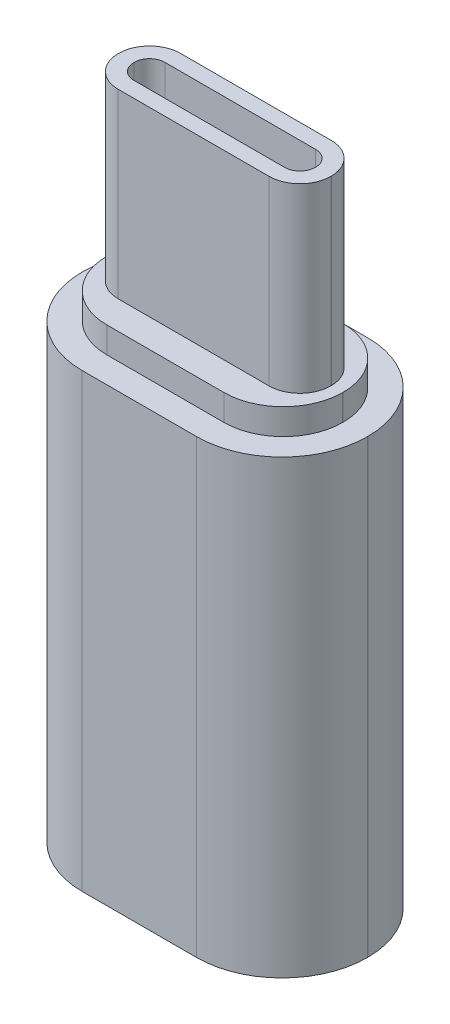
from build123d import *

# Parameters (mm, degrees)
BOSS_EXTRUDE1_DEPTH = 17.4
BOSS_EXTRUDE2_DEPTH = 1
BOSS_EXTRUDE3_DEPTH = 7
CUT_EXTRUDE1_DEPTH  = 4
CUT_EXTRUDE2_DEPTH  = 6.5
BOSS_EXTRUDE4_DEPTH = 2.1


with BuildPart() as part:
    # Sketch1 → Boss-Extrude1 (new body)
    with BuildSketch(Plane(origin=(0, 0, 0), x_dir=(1, 0, 0), z_dir=(0, 1, 0))):
        with BuildLine():
            Line((3.29, 0), (7.71, 0))
            ThreePointArc((7.71, 0), (10.03638131, 0.96361869), (11, 3.29))
            Line((11, 3.29), (11, 3.31))
            ThreePointArc((11, 3.31), (10.03638131, 5.63638131), (7.71, 6.6))
            Line((7.71, 6.6), (3.29, 6.6))
            ThreePointArc((3.29, 6.6), (0.96361869, 5.63638131), (0, 3.31))
            Line((0, 3.31), (0, 3.29))
            ThreePointArc((0, 3.29), (0.96361869, 0.96361869), (3.29, 0))
        make_face()
    extrude(amount=BOSS_EXTRUDE1_DEPTH)

    # Sketch2 → Boss-Extrude2 (add)
    with BuildSketch(Plane(origin=(0, 17.4, 0), x_dir=(1, 0, 0), z_dir=(0, 1, 0))):
        with BuildLine():
            Line((3.24, 1), (7.76, 1))
            ThreePointArc((7.76, 1), (9.379274529, 1.670725471), (10.05, 3.29))
            Line((10.05, 3.29), (10.05, 3.31))
            ThreePointArc((10.05, 3.31), (9.379274529, 4.929274529), (7.76, 5.6))
            Line((7.76, 5.6), (3.24, 5.6))
            ThreePointArc((3.24, 5.6), (1.620725471, 4.929274529), (0.95, 3.31))
            Line((0.95, 3.31), (0.95, 3.29))
            ThreePointArc((0.95, 3.29), (1.620725471, 1.670725471), (3.24, 1))
        make_face()
    extrude(amount=BOSS_EXTRUDE2_DEPTH)

    # Sketch3 → Boss-Extrude3 (add)
    with BuildSketch(Plane(origin=(0, 18.4, 0), x_dir=(1, 0, 0), z_dir=(0, 1, 0))):
        with BuildLine():
            Line((2.59, 2.09), (8.41, 2.09))
            ThreePointArc((8.41, 2.09), (9.25145707, 2.43854293), (9.6, 3.28))
            Line((9.6, 3.28), (9.6, 3.3))
            ThreePointArc((9.6, 3.3), (9.25145707, 4.14145707), (8.41, 4.49))
            Line((8.41, 4.49), (2.59, 4.49))
            ThreePointArc((2.59, 4.49), (1.74854293, 4.14145707), (1.4, 3.3))
            Line((1.4, 3.3), (1.4, 3.28))
            ThreePointArc((1.4, 3.28), (1.74854293, 2.43854293), (2.59, 2.09))
        make_face()
    extrude(amount=BOSS_EXTRUDE3_DEPTH)

    # Sketch4 → Cut-Extrude1 (cut)
    with BuildSketch(Plane(origin=(0, 25.4, 0), x_dir=(1, 0, 0), z_dir=(0, 1, 0))):
        with BuildLine():
            Line((2.59, 3.89), (8.41, 3.89))
            ThreePointArc((8.41, 3.89), (8.828957038, 3.715421473), (8.999978813, 3.295))
            ThreePointArc((8.999978813, 3.295), (8.832522189, 2.868133654), (8.41, 2.69))
            Line((8.41, 2.69), (2.59, 2.69))
            ThreePointArc((2.59, 2.69), (2.171042962, 2.864578527), (2.000021187, 3.285))
            ThreePointArc((2.000021187, 3.285), (2.167477811, 3.711866346), (2.59, 3.89))
        make_face()
    extrude(amount=-CUT_EXTRUDE1_DEPTH, mode=Mode.SUBTRACT)

    # Sketch5 → Cut-Extrude2 (cut)
    with BuildSketch(Plane.XZ):
        with BuildLine():
            Line((2.55, -4.75), (8.45, -4.75))
            ThreePointArc((8.45, -4.75), (9.298528137, -4.398528137), (9.65, -3.55))
            Line((9.65, -3.55), (9.65, -3.05))
            ThreePointArc((9.65, -3.05), (9.298528137, -2.201471863), (8.45, -1.85))
            Line((8.45, -1.85), (2.55, -1.85))
            ThreePointArc((2.55, -1.85), (1.701471863, -2.201471863), (1.35, -3.05))
            Line((1.35, -3.05), (1.35, -3.55))
            ThreePointArc((1.35, -3.55), (1.701471863, -4.398528137), (2.55, -4.75))
        make_face()
    extrude(amount=-CUT_EXTRUDE2_DEPTH, mode=Mode.SUBTRACT)

    # Sketch6 → Boss-Extrude4 (add)
    with BuildSketch(Plane.XZ.offset(-6.5)):
        with BuildLine():
            Line((2.59, -3.85), (8.41, -3.85))
            ThreePointArc((8.41, -3.85), (8.791837662, -3.691837662), (8.95, -3.31))
            Line((8.95, -3.31), (8.95, -3.29))
            ThreePointArc((8.95, -3.29), (8.791837662, -2.908162338), (8.41, -2.75))
            Line((8.41, -2.75), (2.59, -2.75))
            ThreePointArc((2.59, -2.75), (2.208162338, -2.908162338), (2.05, -3.29))
            Line((2.05, -3.29), (2.05, -3.31))
            ThreePointArc((2.05, -3.31), (2.208162338, -3.691837662), (2.59, -3.85))
        make_face()
    extrude(amount=BOSS_EXTRUDE4_DEPTH)


solid = part.part
